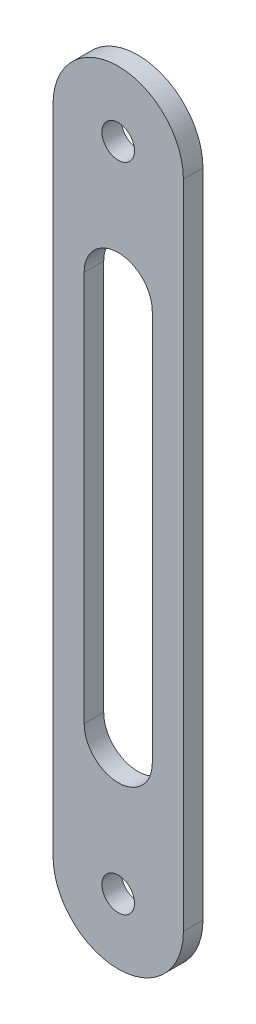
from build123d import *

# Parameters (mm, degrees)
SKETCH1_R           = 2.5
BOSS_EXTRUDE1_DEPTH = 3


with BuildPart() as part:
    # Sketch1 → Boss-Extrude1 (new body)
    with BuildSketch(Plane.XY):
        with BuildLine():
            Line((10, 0), (10, -100))
            ThreePointArc((10, -100), (0, -110), (-10, -100))
            Line((-10, -100), (-10, 0))
            ThreePointArc((-10, 0), (0, 10), (10, 0))
        make_face()
        Circle(SKETCH1_R, mode=Mode.SUBTRACT)
        with Locations((0, -100)):
            Circle(SKETCH1_R, mode=Mode.SUBTRACT)
        with BuildLine():
            Line((-5.226442404, -80), (-5.226442404, -20))
            ThreePointArc((-5.226442404, -20), (0, -14.773557596), (5.226442404, -20))
            Line((5.226442404, -20), (5.226442404, -80))
            ThreePointArc((5.226442404, -80), (0, -85.226442404), (-5.226442404, -80))
        make_face(mode=Mode.SUBTRACT)
    extrude(amount=BOSS_EXTRUDE1_DEPTH)


solid = part.part
